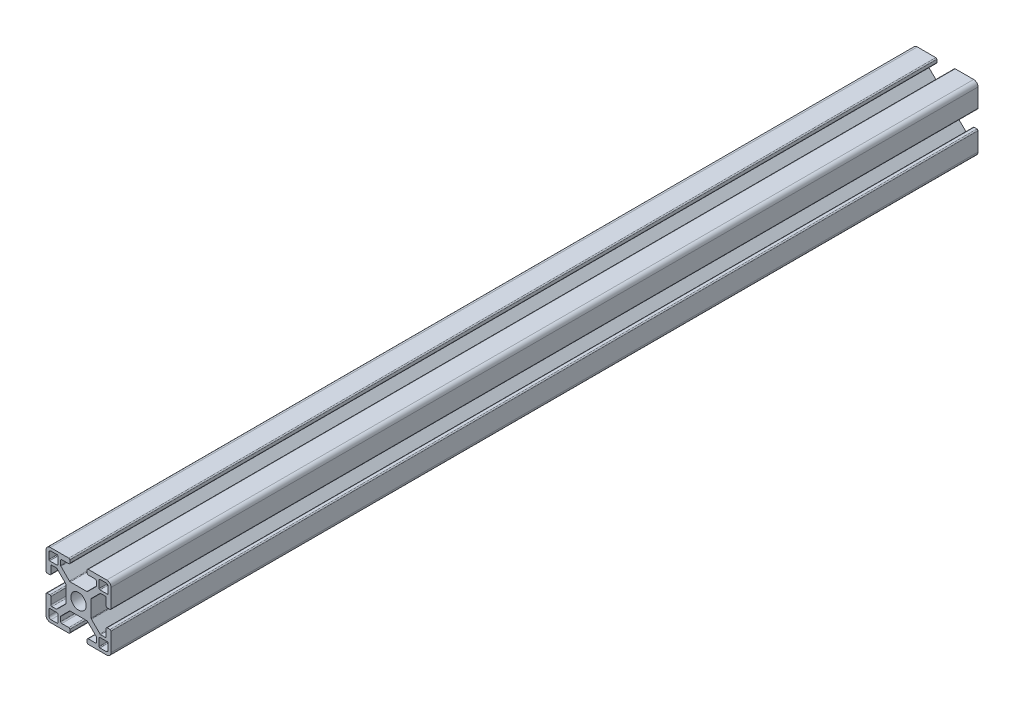
from build123d import *

# Parameters (mm, degrees)
SKETCH1_R           = 3.52998588
BOSS_EXTRUDE1_DEPTH = 200


with BuildPart() as part:
    # Sketch1 → Boss-Extrude1 (new, symmetric)
    with BuildSketch(Plane.XY):
        with BuildLine():
            Line((14.49994, -4), (13.24247465, -4))
            ThreePointArc((13.24247465, -4), (12.88892126, -4.146446609), (12.74247465, -4.5))
            Line((12.74247465, -4.5), (12.74247465, -7.732519321))
            ThreePointArc((12.74247465, -7.732519321), (12.602449697, -8.097296796), (12.242781236, -8.249967))
            Line((12.242781236, -8.249967), (10.260188032, -8.249967))
            ThreePointArc((10.260188032, -8.249967), (10.068847082, -8.211906919), (9.906636056, -8.103520976))
            Line((9.906636056, -8.103520976), (5.981117769, -4.178002689))
            ThreePointArc((5.981117769, -4.178002689), (5.872731827, -4.015791664), (5.834671745, -3.824450713))
            Line((5.834671745, -3.824450713), (5.834671745, -1.01249595))
            Line((5.834671745, -1.01249595), (5.834671745, 0.88749645))
            Line((5.834671745, 0.88749645), (5.834671745, 3.824450713))
            ThreePointArc((5.834671745, 3.824450713), (5.872731827, 4.015791664), (5.981117769, 4.178002689))
            Line((5.981117769, 4.178002689), (9.906636056, 8.103520976))
            ThreePointArc((9.906636056, 8.103520976), (10.068847082, 8.211906919), (10.260188032, 8.249967))
            Line((10.260188032, 8.249967), (12.242781236, 8.249967))
            ThreePointArc((12.242781236, 8.249967), (12.602449697, 8.097296796), (12.74247465, 7.732519321))
            Line((12.74247465, 7.732519321), (12.74247465, 4.5))
            ThreePointArc((12.74247465, 4.5), (12.88892126, 4.146446609), (13.24247465, 4))
            Line((13.24247465, 4), (14.49994, 4))
            ThreePointArc((14.49994, 4), (14.853493391, 4.146446609), (14.99994, 4.5))
            Line((14.99994, 4.5), (14.99994, 12.999948))
            ThreePointArc((14.99994, 12.999948), (14.414155906, 14.414155906), (12.999948, 14.99994))
            Line((12.999948, 14.99994), (4.5, 14.99994))
            ThreePointArc((4.5, 14.99994), (4.146446609, 14.853493391), (4, 14.49994))
            Line((4, 14.49994), (4, 13.24247465))
            ThreePointArc((4, 13.24247465), (4.146446609, 12.88892126), (4.5, 12.74247465))
            Line((4.5, 12.74247465), (7.732519321, 12.74247465))
            ThreePointArc((7.732519321, 12.74247465), (8.097296796, 12.602449697), (8.249967, 12.242781236))
            Line((8.249967, 12.242781236), (8.249967, 10.260188032))
            ThreePointArc((8.249967, 10.260188032), (8.211906919, 10.068847082), (8.103520976, 9.906636056))
            Line((8.103520976, 9.906636056), (4.178002689, 5.981117769))
            ThreePointArc((4.178002689, 5.981117769), (4.015791664, 5.872731827), (3.824450713, 5.834671745))
            Line((3.824450713, 5.834671745), (0.9499962, 5.834671745))
            Line((0.9499962, 5.834671745), (-0.9499962, 5.834671745))
            Line((-0.9499962, 5.834671745), (-3.824450713, 5.834671745))
            ThreePointArc((-3.824450713, 5.834671745), (-4.015791664, 5.872731827), (-4.178002689, 5.981117769))
            Line((-4.178002689, 5.981117769), (-8.103520976, 9.906636056))
            ThreePointArc((-8.103520976, 9.906636056), (-8.211906919, 10.068847082), (-8.249967, 10.260188032))
            Line((-8.249967, 10.260188032), (-8.249967, 12.242781236))
            ThreePointArc((-8.249967, 12.242781236), (-8.097296796, 12.602449697), (-7.732519321, 12.74247465))
            Line((-7.732519321, 12.74247465), (-4.5, 12.74247465))
            ThreePointArc((-4.5, 12.74247465), (-4.146446609, 12.88892126), (-4, 13.24247465))
            Line((-4, 13.24247465), (-4, 14.49994))
            ThreePointArc((-4, 14.49994), (-4.146446609, 14.853493391), (-4.5, 14.99994))
            Line((-4.5, 14.99994), (-12.999948, 14.99994))
            ThreePointArc((-12.999948, 14.99994), (-14.414155906, 14.414155906), (-14.99994, 12.999948))
            Line((-14.99994, 12.999948), (-14.99994, 4.5))
            ThreePointArc((-14.99994, 4.5), (-14.853493391, 4.146446609), (-14.49994, 4))
            Line((-14.49994, 4), (-13.24247465, 4))
            ThreePointArc((-13.24247465, 4), (-12.88892126, 4.146446609), (-12.74247465, 4.5))
            Line((-12.74247465, 4.5), (-12.74247465, 7.732519321))
            ThreePointArc((-12.74247465, 7.732519321), (-12.602449697, 8.097296796), (-12.242781236, 8.249967))
            Line((-12.242781236, 8.249967), (-10.260188032, 8.249967))
            ThreePointArc((-10.260188032, 8.249967), (-10.068847082, 8.211906919), (-9.906636056, 8.103520976))
            Line((-9.906636056, 8.103520976), (-5.981117769, 4.178002689))
            ThreePointArc((-5.981117769, 4.178002689), (-5.872731827, 4.015791664), (-5.834671745, 3.824450713))
            Line((-5.834671745, 3.824450713), (-5.834671745, 0.88749645))
            Line((-5.834671745, 0.88749645), (-5.834671745, -1.01249595))
            Line((-5.834671745, -1.01249595), (-5.834671745, -3.824450713))
            ThreePointArc((-5.834671745, -3.824450713), (-5.872731827, -4.015791664), (-5.981117769, -4.178002689))
            Line((-5.981117769, -4.178002689), (-9.906636056, -8.103520976))
            ThreePointArc((-9.906636056, -8.103520976), (-10.068847082, -8.211906919), (-10.260188032, -8.249967))
            Line((-10.260188032, -8.249967), (-12.242781236, -8.249967))
            ThreePointArc((-12.242781236, -8.249967), (-12.602449697, -8.097296796), (-12.74247465, -7.732519321))
            Line((-12.74247465, -7.732519321), (-12.74247465, -4.5))
            ThreePointArc((-12.74247465, -4.5), (-12.88892126, -4.146446609), (-13.24247465, -4))
            Line((-13.24247465, -4), (-14.49994, -4))
            ThreePointArc((-14.49994, -4), (-14.853493391, -4.146446609), (-14.99994, -4.5))
            Line((-14.99994, -4.5), (-14.99994, -12.999948))
            ThreePointArc((-14.99994, -12.999948), (-14.414155906, -14.414155906), (-12.999948, -14.99994))
            Line((-12.999948, -14.99994), (-4.5, -14.99994))
            ThreePointArc((-4.5, -14.99994), (-4.146446609, -14.853493391), (-4, -14.49994))
            Line((-4, -14.49994), (-4, -13.24247465))
            ThreePointArc((-4, -13.24247465), (-4.146446609, -12.88892126), (-4.5, -12.74247465))
            Line((-4.5, -12.74247465), (-7.732519321, -12.74247465))
            ThreePointArc((-7.732519321, -12.74247465), (-8.097296796, -12.602449697), (-8.249967, -12.242781236))
            Line((-8.249967, -12.242781236), (-8.249967, -10.260188032))
            ThreePointArc((-8.249967, -10.260188032), (-8.211906919, -10.068847082), (-8.103520976, -9.906636056))
            Line((-8.103520976, -9.906636056), (-4.178002689, -5.981117769))
            ThreePointArc((-4.178002689, -5.981117769), (-4.015791664, -5.872731827), (-3.824450713, -5.834671745))
            Line((-3.824450713, -5.834671745), (-0.9499962, -5.834671745))
            Line((-0.9499962, -5.834671745), (0.9499962, -5.834671745))
            Line((0.9499962, -5.834671745), (3.824450713, -5.834671745))
            ThreePointArc((3.824450713, -5.834671745), (4.015791664, -5.872731827), (4.178002689, -5.981117769))
            Line((4.178002689, -5.981117769), (8.103520976, -9.906636056))
            ThreePointArc((8.103520976, -9.906636056), (8.211906919, -10.068847082), (8.249967, -10.260188032))
            Line((8.249967, -10.260188032), (8.249967, -12.242781236))
            ThreePointArc((8.249967, -12.242781236), (8.097296796, -12.602449697), (7.732519321, -12.74247465))
            Line((7.732519321, -12.74247465), (4.5, -12.74247465))
            ThreePointArc((4.5, -12.74247465), (4.146446609, -12.88892126), (4, -13.24247465))
            Line((4, -13.24247465), (4, -14.49994))
            ThreePointArc((4, -14.49994), (4.146446609, -14.853493391), (4.5, -14.99994))
            Line((4.5, -14.99994), (12.999948, -14.99994))
            ThreePointArc((12.999948, -14.99994), (14.414155906, -14.414155906), (14.99994, -12.999948))
            Line((14.99994, -12.999948), (14.99994, -4.5))
            ThreePointArc((14.99994, -4.5), (14.853493391, -4.146446609), (14.49994, -4))
        make_face()
        Circle(SKETCH1_R, mode=Mode.SUBTRACT)
        with BuildLine():
            Line((-12.6999492, -13.6999452), (-9.880960476, -13.6999452))
            ThreePointArc((-9.880960476, -13.6999452), (-9.61155387, -13.58835333), (-9.499962, -13.318946724))
            Line((-9.499962, -13.318946724), (-9.499962, -9.87996048))
            ThreePointArc((-9.499962, -9.87996048), (-9.611260978, -9.611260978), (-9.87996048, -9.499962))
            Line((-9.87996048, -9.499962), (-13.318946724, -9.499962))
            ThreePointArc((-13.318946724, -9.499962), (-13.58835333, -9.61155387), (-13.6999452, -9.880960476))
            Line((-13.6999452, -9.880960476), (-13.6999452, -12.6999492))
            ThreePointArc((-13.6999452, -12.6999492), (-13.407053153, -13.407053153), (-12.6999492, -13.6999452))
        make_face(mode=Mode.SUBTRACT)
        with BuildLine():
            Line((13.6999452, -12.6999492), (13.6999452, -9.880960476))
            ThreePointArc((13.6999452, -9.880960476), (13.58835333, -9.61155387), (13.318946724, -9.499962))
            Line((13.318946724, -9.499962), (9.87996048, -9.499962))
            ThreePointArc((9.87996048, -9.499962), (9.611260978, -9.611260978), (9.499962, -9.87996048))
            Line((9.499962, -9.87996048), (9.499962, -13.318946724))
            ThreePointArc((9.499962, -13.318946724), (9.61155387, -13.58835333), (9.880960476, -13.6999452))
            Line((9.880960476, -13.6999452), (12.6999492, -13.6999452))
            ThreePointArc((12.6999492, -13.6999452), (13.407053153, -13.407053153), (13.6999452, -12.6999492))
        make_face(mode=Mode.SUBTRACT)
        with BuildLine():
            Line((9.87996048, 9.499962), (13.318946724, 9.499962))
            ThreePointArc((13.318946724, 9.499962), (13.58835333, 9.61155387), (13.6999452, 9.880960476))
            Line((13.6999452, 9.880960476), (13.6999452, 12.6999492))
            ThreePointArc((13.6999452, 12.6999492), (13.407053153, 13.407053153), (12.6999492, 13.6999452))
            Line((12.6999492, 13.6999452), (9.880960476, 13.6999452))
            ThreePointArc((9.880960476, 13.6999452), (9.61155387, 13.58835333), (9.499962, 13.318946724))
            Line((9.499962, 13.318946724), (9.499962, 9.87996048))
            ThreePointArc((9.499962, 9.87996048), (9.611260978, 9.611260978), (9.87996048, 9.499962))
        make_face(mode=Mode.SUBTRACT)
        with BuildLine():
            Line((-13.6999452, 12.6999492), (-13.6999452, 9.880960476))
            ThreePointArc((-13.6999452, 9.880960476), (-13.58835333, 9.61155387), (-13.318946724, 9.499962))
            Line((-13.318946724, 9.499962), (-9.87996048, 9.499962))
            ThreePointArc((-9.87996048, 9.499962), (-9.611260978, 9.611260978), (-9.499962, 9.87996048))
            Line((-9.499962, 9.87996048), (-9.499962, 13.318946724))
            ThreePointArc((-9.499962, 13.318946724), (-9.61155387, 13.58835333), (-9.880960476, 13.6999452))
            Line((-9.880960476, 13.6999452), (-12.6999492, 13.6999452))
            ThreePointArc((-12.6999492, 13.6999452), (-13.407053153, 13.407053153), (-13.6999452, 12.6999492))
        make_face(mode=Mode.SUBTRACT)
    extrude(amount=BOSS_EXTRUDE1_DEPTH, both=True)


solid = part.part
